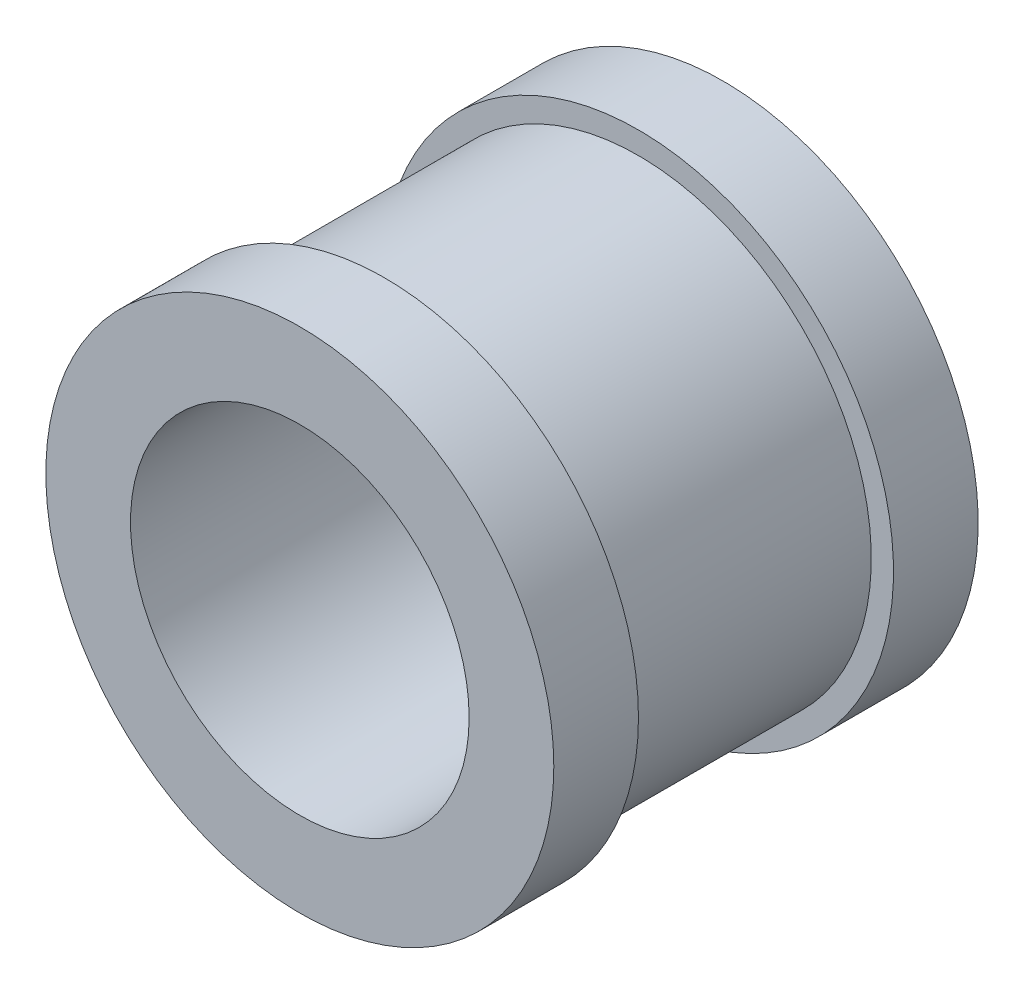
from build123d import *

# Parameters (mm, degrees)
SKETCH_1_R      = 2.75
SKETCH_1_R_2    = 2
EXTRUDE_1_DEPTH = 5
EXTRUDE_START   = -1
SKETCH_2_R      = 3
SKETCH_2_R_2    = 2
EXTRUDE_2_DEPTH = 1
SKETCH_3_R      = 3.012416382
SKETCH_3_R_2    = 2
EXTRUDE_3_DEPTH = 1


with BuildPart() as part:
    # 草图1 → 凸台-拉伸1 (new body)
    with BuildSketch(Plane.XY):
        Circle(SKETCH_1_R)
        Circle(SKETCH_1_R_2, mode=Mode.SUBTRACT)
    extrude(amount=EXTRUDE_1_DEPTH)

    # 草图2 → 凸台-拉伸2 (add)
    with BuildSketch(Plane.XY.offset(5).offset(EXTRUDE_START)):
        Circle(SKETCH_2_R)
        Circle(SKETCH_2_R_2, mode=Mode.SUBTRACT)
    extrude(amount=EXTRUDE_2_DEPTH)

    # 草图3 → 凸台-拉伸3 (add)
    with BuildSketch(Plane(origin=(0, 0, 0), x_dir=(-1, 0, 0), z_dir=(0, 0, -1))):
        Circle(SKETCH_3_R)
        with Locations(Location((0, 0, 0), (0, 0, 180))):
            Circle(SKETCH_3_R_2, mode=Mode.SUBTRACT)
    extrude(amount=-EXTRUDE_3_DEPTH)


solid = part.part
